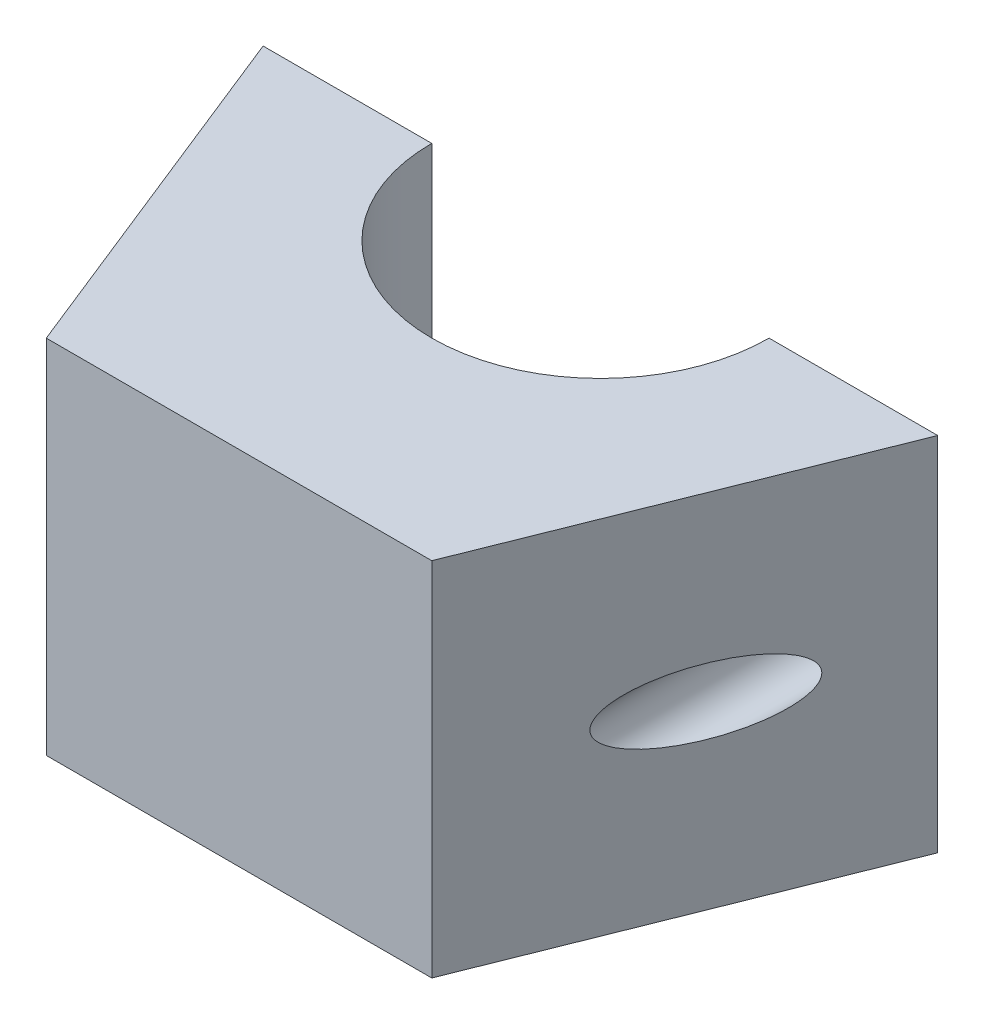
from build123d import *

# Parameters (mm, degrees)
SKETCH1_W           = 40
SKETCH1_H           = 30
BOSS_EXTRUDE1_DEPTH = 15
CUT_EXTRUDE1_DEPTH  = 15
SKETCH3_R           = 1.375
CUT_EXTRUDE2_DEPTH  = 15


with BuildPart() as part:
    # Sketch1 → Boss-Extrude1 (new body)
    with BuildSketch(Plane(origin=(0, 0, 0), x_dir=(1, 0, 0), z_dir=(0, 1, 0))):
        with Locations((-14.816176471, 3.033088235)):
            Rectangle(SKETCH1_W, SKETCH1_H)
    extrude(amount=BOSS_EXTRUDE1_DEPTH)

    # Sketch2 → Cut-Extrude1 (cut)
    with BuildSketch(Plane(origin=(0, 15, 0), x_dir=(1, 0, 0), z_dir=(0, 1, 0))):
        Polygon((-28.816176471, 3.033088235), (-28.816176471, 18.033088235), (-34.816176471, 18.033088235), align=None)
        with BuildLine():
            Line((-0.816176471, 18.033088235), (-28.816176471, 18.033088235))
            Line((-28.816176471, 18.033088235), (-28.816176471, 3.033088235))
            Line((-28.816176471, 3.033088235), (-21.816176471, 3.033088235))
            ThreePointArc((-21.816176471, 3.033088235), (-14.816176471, 10.033088235), (-7.816176471, 3.033088235))
            Line((-7.816176471, 3.033088235), (-0.816176471, 3.033088235))
            Line((-0.816176471, 3.033088235), (-0.816176471, 18.033088235))
        make_face()
        Polygon((5.183823529, 18.033088235), (-0.816176471, 18.033088235), (-0.816176471, 3.033088235), align=None)
        Polygon((5.183823529, 18.033088235), (-0.816176471, 3.033088235), (-0.816176471, -11.966911765), (5.183823529, -11.966911765), align=None)
        Polygon((-0.816176471, -11.966911765), (-0.816176471, 3.033088235), (-6.816176471, -11.966911765), align=None)
        Polygon((-22.816176471, -11.966911765), (-28.816176471, 3.033088235), (-28.816176471, -11.966911765), align=None)
        Polygon((-28.816176471, -11.966911765), (-28.816176471, 3.033088235), (-34.816176471, 18.033088235), (-34.816176471, -11.966911765), align=None)
        with BuildLine():
            ThreePointArc((-7.816176471, 3.033088235), (-14.816176471, 10.033088235), (-21.816176471, 3.033088235))
            Line((-21.816176471, 3.033088235), (-7.816176471, 3.033088235))
        make_face()
        with BuildLine():
            Line((-7.816176471, 3.033088235), (-21.816176471, 3.033088235))
            ThreePointArc((-21.816176471, 3.033088235), (-14.816176471, -3.966911765), (-7.816176471, 3.033088235))
        make_face()
    extrude(amount=-CUT_EXTRUDE1_DEPTH, mode=Mode.SUBTRACT)

    # Sketch3 → Cut-Extrude2 (cut)
    with BuildSketch(Plane(origin=(0, 0, -3.033088235), x_dir=(-1, 0, 0), z_dir=(0, 0, -1))):
        with Locations((3.566176471, 7.5)):
            Circle(SKETCH3_R)
        with Locations((26.066176471, 7.5)):
            Circle(SKETCH3_R)
    extrude(amount=-CUT_EXTRUDE2_DEPTH, mode=Mode.SUBTRACT)


solid = part.part
